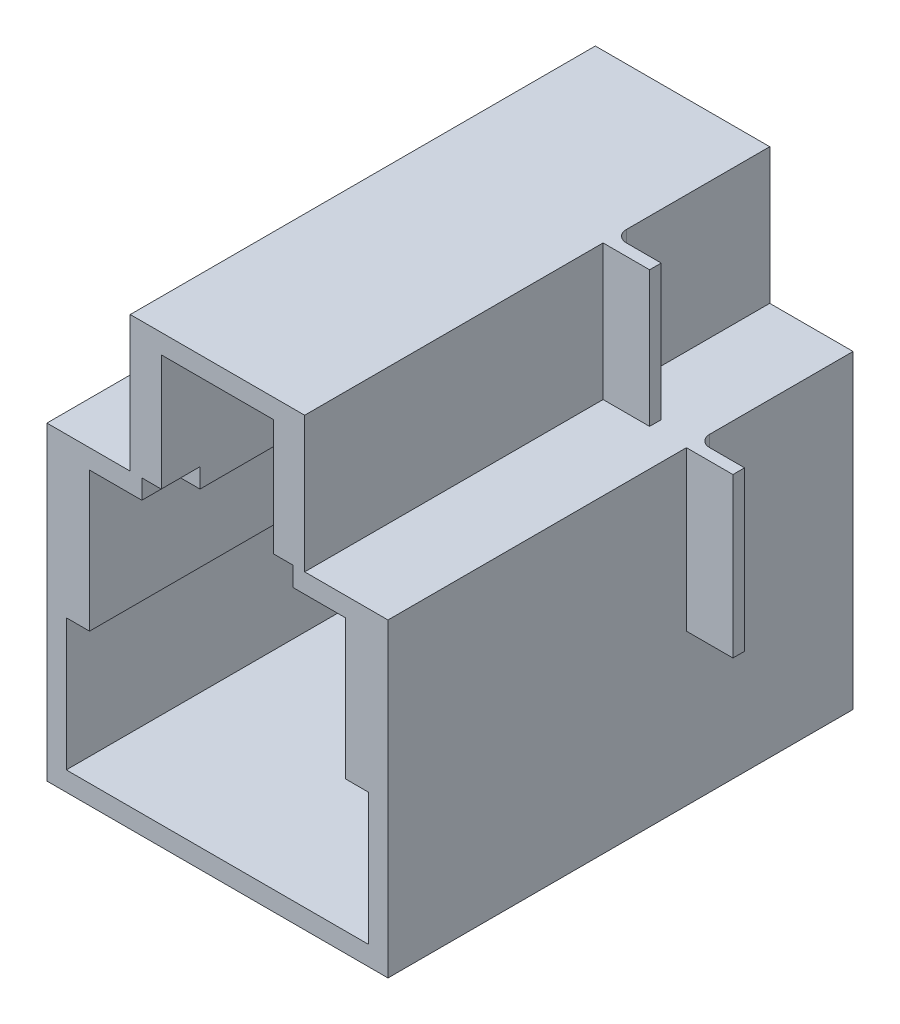
from build123d import *

# Parameters (mm, degrees)
BOSS_EXTRUDE1_DEPTH             = 60
SHELL1_T                        = -2.5
SKETCH2_W                       = 1.5
SKETCH2_H                       = 17.5
BOSS_EXTRUDE2_DEPTH             = 57.5
SKETCH4_W                       = 3
SKETCH4_H                       = 18
BOSS_EXTRUDE4_DEPTH             = 57.5
CUT_EXTRUDE1_DEPTH              = 86.966563267
CUT_EXTRUDE1_DEPTH_BACK         = 5
SKETCH5_W                       = 2.5
SKETCH5_H                       = 2.5
BOSS_EXTRUDE5_DEPTH             = 5
SKETCH13_W                      = 1.5
SKETCH13_H                      = 20.5
BOSS_EXTRUDE8_DEPTH             = 6
SKETCH14_W                      = 17.5
SKETCH14_H                      = 1.5
BOSS_EXTRUDE9_DEPTH             = 6
SKETCH15_W                      = 1.5
SKETCH15_H                      = 20.5
BOSS_EXTRUDE10_DEPTH            = 6
FILLET7_R                       = 1.5
CUT_EXTRUDE7_DEPTH              = 2.5
CUT_EXTRUDE7_DRAFT              = 30
CUT_EXTRUDE8_DEPTH              = 4
CUT_EXTRUDE8_DRAFT              = 30
REVOLVE4_ANGLE                  = 90
FILLET9_R                       = 1.5
BOSS_EXTRUDE13_DEPTH            = 2.5
BOSS_EXTRUDE14_DEPTH            = 4
CUT_EXTRUDE9_REACH              = 89.694
CUT_EXTRUDE9_DIRECTION_2_REACH  = 89.694
CUT_EXTRUDE10_REACH             = 88.076
CUT_EXTRUDE10_DIRECTION_2_REACH = 88.076
SKETCH27_W                      = 5
SKETCH27_H                      = 17
BOSS_EXTRUDE15_DEPTH            = 2.5
BOSS_EXTRUDE16_DEPTH            = 5.5
SKETCH29_W                      = 9.25
SKETCH29_H                      = 1.666666667
BOSS_EXTRUDE17_DEPTH            = 2.5
SKETCH30_W                      = 3.942307692
SKETCH30_H                      = 17.5
BOSS_EXTRUDE18_DEPTH            = 4
SKETCH31_W                      = 5
SKETCH31_H                      = 17
BOSS_EXTRUDE19_DEPTH            = 2.5
SKETCH32_W                      = 4.464285714
SKETCH32_H                      = 20.5
BOSS_EXTRUDE20_DEPTH            = 5.5
SKETCH35_W                      = 9.25
SKETCH35_H                      = 1.666666667
BOSS_EXTRUDE21_DEPTH            = 2.5
SKETCH36_W                      = 1.428571429
SKETCH36_H                      = 17.5
BOSS_EXTRUDE22_DEPTH            = 4
SKETCH37_W                      = 15.607142857
SKETCH37_H                      = 3.429487179
BOSS_EXTRUDE23_DEPTH            = 2.5
SKETCH38_W                      = 39
SKETCH38_H                      = 5
BOSS_EXTRUDE24_DEPTH            = 2.5


with BuildPart() as part:
    # Sketch1 → Boss-Extrude1 (new body)
    with BuildSketch(Plane.XY):
        Polygon((-22, 0), (22, 0), (22, 40), (11.25, 40), (11.25, 57.5), (-11.25, 57.5), (-11.25, 40), (-22, 40), align=None)
    extrude(amount=BOSS_EXTRUDE1_DEPTH)

    # Shell1
    shell1_openings = [part.faces().sort_by_distance(p)[0] for p in [
        (0, 25.256094022, 60),
    ]]
    offset(amount=SHELL1_T, openings=shell1_openings, kind=Kind.INTERSECTION)

    # Sketch2 → Boss-Extrude2 (add)
    with BuildSketch(Plane.XY.offset(2.5)):
        with Locations((-8, 46.25)):
            Rectangle(SKETCH2_W, SKETCH2_H)
        with Locations((8, 46.25)):
            Rectangle(SKETCH2_W, SKETCH2_H)
    extrude(amount=BOSS_EXTRUDE2_DEPTH)

    # Sketch4 → Boss-Extrude4 (add)
    with BuildSketch(Plane.XY.offset(2.5)):
        with Locations((-18, 28.5)):
            Rectangle(SKETCH4_W, SKETCH4_H)
        with Locations((18, 28.5)):
            Rectangle(SKETCH4_W, SKETCH4_H)
    extrude(amount=BOSS_EXTRUDE4_DEPTH)

    # Sketch5 → Cut-Extrude1 (cut, two sides: drawn at the far end of the back side and taken through both)
    with BuildSketch(Plane.XY.offset(60).offset(-CUT_EXTRUDE1_DEPTH_BACK)):
        with Locations((-8.5, 38.75)):
            Rectangle(SKETCH5_W, SKETCH5_H)
        with Locations((8.5, 38.75)):
            Rectangle(SKETCH5_W, SKETCH5_H)
    extrude(amount=CUT_EXTRUDE1_DEPTH + CUT_EXTRUDE1_DEPTH_BACK, mode=Mode.SUBTRACT)

    # Sketch7 → Boss-Extrude5 (add)
    with BuildSketch(Plane.XY.offset(2.5)):
        Polygon((-7.25, 55), (7.25, 55), (7.25, 37.5), (16.5, 37.5), (16.5, 19.5), (19.5, 19.5), (19.5, 2.5), (-19.5, 2.5), (-19.5, 19.5), (-16.5, 19.5), (-16.5, 37.5), (-7.25, 37.5), align=None)
    extrude(amount=BOSS_EXTRUDE5_DEPTH)

    # Sketch13 → Boss-Extrude8 (add)
    with BuildSketch(Plane.ZY.offset(22)):
        with Locations((20.75, 29.75)):
            Rectangle(SKETCH13_W, SKETCH13_H)
    extrude(amount=BOSS_EXTRUDE8_DEPTH)

    # Sketch14 → Boss-Extrude9 (add)
    with BuildSketch(Plane(origin=(11.25, 46.25, 0), x_dir=(0, 1, 0), z_dir=(-1, 0, 0))):
        with Locations((2.5, -20.75)):
            Rectangle(SKETCH14_W, SKETCH14_H)
    extrude(amount=-BOSS_EXTRUDE9_DEPTH)

    # Sketch15 → Boss-Extrude10 (add)
    with BuildSketch(Plane(origin=(22, 0, 0), x_dir=(0, 0, -1), z_dir=(1, 0, 0))):
        with Locations((-20.75, 29.75)):
            Rectangle(SKETCH15_W, SKETCH15_H)
    extrude(amount=BOSS_EXTRUDE10_DEPTH)

    # Fillet7
    fillet7_edges = [part.edges().sort_by_distance(p)[0] for p in [
        (-22, 29.75, 20),
        (11.25, 48.75, 20),
        (22, 29.75, 20),
    ]]
    fillet(fillet7_edges, radius=FILLET7_R)


with BuildPart() as cut_extrude7_tool:
    # Sketch21 → Cut-Extrude7 (with draft: the straight prism first)
    with BuildSketch(Plane(origin=(0, 40, 0), x_dir=(1, 0, 0), z_dir=(0, 1, 0))):
        with BuildLine():
            ThreePointArc((-11.25, -30), (-14.9, -33.65), (-11.25, -37.3))
            Line((-11.25, -37.3), (-7.25, -37.3))
            Line((-7.25, -37.3), (-7.25, -30))
            Line((-7.25, -30), (-11.25, -30))
        make_face()
    extrude(amount=-CUT_EXTRUDE7_DEPTH)
    # Cut-Extrude7: the draft: its side faces are tilted about the plane it starts from
    cut_extrude7_sides = [cut_extrude7_tool.faces().sort_by_distance(p)[0] for p in [
        (-9.25, 38.75, 30),
        (-14.9, 38.75, 33.65),
        (-9.25, 38.75, 37.3),
        (-7.25, 38.75, 33.65),
    ]]
    draft(cut_extrude7_sides, Plane(origin=(0, 40, 0), x_dir=(1, 0, 0), z_dir=(0, 1, 0)), CUT_EXTRUDE7_DRAFT)


with BuildPart() as part_1:
    add(part.part)

    # Cut-Extrude7: cut by cut_extrude7_tool
    add(cut_extrude7_tool.part, mode=Mode.SUBTRACT)


with BuildPart() as cut_extrude8_tool:
    # Sketch22 → Cut-Extrude8 (with draft: the straight prism first)
    with BuildSketch(Plane.ZY.offset(11.25)):
        with BuildLine():
            ThreePointArc((37.3, 40), (33.65, 43.65), (30, 40))
            Line((30, 40), (30, 37.5))
            Line((30, 37.5), (37.3, 37.5))
            Line((37.3, 37.5), (37.3, 40))
        make_face()
    extrude(amount=-CUT_EXTRUDE8_DEPTH)
    # Cut-Extrude8: the draft: its side faces are tilted about the plane it starts from
    cut_extrude8_sides = [cut_extrude8_tool.faces().sort_by_distance(p)[0] for p in [
        (-9.25, 38.75, 30),
        (-9.25, 37.5, 33.65),
        (-9.25, 38.75, 37.3),
        (-9.25, 43.65, 33.65),
    ]]
    draft(cut_extrude8_sides, Plane.ZY.offset(11.25), CUT_EXTRUDE8_DRAFT)


with BuildPart() as part_2:
    add(part_1.part)

    # Cut-Extrude8: cut by cut_extrude8_tool
    add(cut_extrude8_tool.part, mode=Mode.SUBTRACT)

    # Sketch23 → Revolve4 (revolve)
    with BuildSketch(Plane(origin=(0, 40, 0), x_dir=(1, 0, 0), z_dir=(0, 1, 0))):
        with BuildLine():
            Line((-14.634221069, -32.282685934), (-18.55, -41.974578887))
            Line((-18.55, -41.974578887), (-19.755339011, -41.487590315))
            Line((-19.755339011, -41.487590315), (-15.83956008, -31.795697363))
            ThreePointArc((-15.83956008, -31.795697363), (-14.018004872, -29.546264016), (-11.25, -28.7))
            Line((-11.25, -28.7), (-11.25, -30))
            ThreePointArc((-11.25, -30), (-13.291054098, -30.62401286), (-14.634221069, -32.282685934))
        make_face()
    revolve(axis=Axis((-11.25, 40, 30), (0, 0, -1)), revolution_arc=REVOLVE4_ANGLE)

    # Fillet9
    fillet9_edges = [part_2.edges().sort_by_distance(p)[0] for p in [
        (-14.018004872, 40, 29.546264016),
        (-17.797449546, 40, 36.641643839),
        (-11.25, 42.768004872, 29.546264016),
        (-11.25, 46.547449546, 36.641643839),
    ]]
    fillet(fillet9_edges, radius=FILLET9_R)

    # Sketch24 → Boss-Extrude13 (add)
    with BuildSketch(Plane.XZ.offset(-37.5)):
        with BuildLine():
            Line((-11.25, 37.3), (-7.25, 37.3))
            Line((-7.25, 37.3), (-7.25, 39.609401077))
            Line((-7.25, 39.609401077), (-11.25, 39.609401077))
            Line((-11.25, 39.609401077), (-16.5, 39.609401077))
            Line((-16.5, 39.609401077), (-16.5, 33.761079936))
            Line((-16.5, 33.761079936), (-14.898309368, 33.761079936))
            ThreePointArc((-14.898309368, 33.761079936), (-13.791363633, 36.269918106), (-11.25, 37.3))
        make_face()
    extrude(amount=-BOSS_EXTRUDE13_DEPTH)

    # Sketch25 → Boss-Extrude14 (add)
    with BuildSketch(Plane(origin=(-7.25, 0, 0), x_dir=(0, 0, -1), z_dir=(1, 0, 0))):
        with BuildLine():
            Line((-37.3, 37.5), (-37.3, 40))
            ThreePointArc((-37.3, 40), (-36.230939751, 42.580939751), (-33.65, 43.65))
            Line((-33.65, 43.65), (-33.65, 45.959401077))
            ThreePointArc((-33.65, 45.959401077), (-37.863932913, 44.213932913), (-39.609401077, 40))
            Line((-39.609401077, 40), (-39.609401077, 37.5))
            Line((-39.609401077, 37.5), (-37.3, 37.5))
        make_face()
    extrude(amount=-BOSS_EXTRUDE14_DEPTH)

    # Sketch26 → Cut-Extrude9 (cut, up to next)
    with BuildSketch(Plane(origin=(0, 0, 0), x_dir=(0, 0, -1), z_dir=(1, 0, 0)), mode=Mode.PRIVATE) as cut_extrude9_sk1:
        Polygon((-7.5, 55), (-7.5, 2.5), (-2.5, 2.5), align=None)
    cut_extrude9_tool1 = extrude(cut_extrude9_sk1.sketch, amount=-CUT_EXTRUDE9_REACH, mode=Mode.PRIVATE) & part_2.part
    add(cut_extrude9_tool1.solids().sort_by_distance((0, 20, 5.833333))[0], mode=Mode.SUBTRACT)

    # Sketch26 → Cut-Extrude9 direction 2 (cut, up to next)
    with BuildSketch(Plane(origin=(0, 0, 0), x_dir=(0, 0, -1), z_dir=(1, 0, 0)), mode=Mode.PRIVATE) as cut_extrude9_direction_2_sk1:
        Polygon((-7.5, 55), (-7.5, 2.5), (-2.5, 2.5), align=None)
    cut_extrude9_direction_2_tool1 = extrude(cut_extrude9_direction_2_sk1.sketch, amount=CUT_EXTRUDE9_DIRECTION_2_REACH, mode=Mode.PRIVATE) & part_2.part
    add(cut_extrude9_direction_2_tool1.solids().sort_by_distance((0, 20, 5.833333))[0], mode=Mode.SUBTRACT)

    # Sketch33 → Cut-Extrude10 (cut, up to next)
    with BuildSketch(Plane(origin=(0, 2.5, 0), x_dir=(1, 0, 0), z_dir=(0, 1, 0)), mode=Mode.PRIVATE) as cut_extrude10_sk1:
        Polygon((-19.5, -7.5), (19.5, -7.5), (-19.5, -2.5), align=None)
    cut_extrude10_tool1 = extrude(cut_extrude10_sk1.sketch, amount=CUT_EXTRUDE10_REACH, mode=Mode.PRIVATE) & part_2.part
    add(cut_extrude10_tool1.solids().sort_by_distance((-6.5, 2.5, 5.833333))[0], mode=Mode.SUBTRACT)

    # Sketch33 → Cut-Extrude10 direction 2 (cut, up to next)
    with BuildSketch(Plane(origin=(0, 2.5, 0), x_dir=(1, 0, 0), z_dir=(0, 1, 0)), mode=Mode.PRIVATE) as cut_extrude10_direction_2_sk1:
        Polygon((-19.5, -7.5), (19.5, -7.5), (-19.5, -2.5), align=None)
    cut_extrude10_direction_2_tool1 = extrude(cut_extrude10_direction_2_sk1.sketch, amount=-CUT_EXTRUDE10_DIRECTION_2_REACH, mode=Mode.PRIVATE) & part_2.part
    add(cut_extrude10_direction_2_tool1.solids().sort_by_distance((-6.5, 2.5, 5.833333))[0], mode=Mode.SUBTRACT)

    # Sketch27 → Boss-Extrude15 (add)
    with BuildSketch(Plane.ZY.offset(22)):
        with Locations((5, 11)):
            Rectangle(SKETCH27_W, SKETCH27_H)
    extrude(amount=-BOSS_EXTRUDE15_DEPTH)

    # Sketch27<4> → Boss-Extrude16 (add)
    with BuildSketch(Plane.ZY.offset(22)):
        Polygon((4.119047619, 19.5), (7.5, 19.5), (7.5, 40), (6.071428571, 40), align=None)
    extrude(amount=-BOSS_EXTRUDE16_DEPTH)

    # Sketch29 → Boss-Extrude17 (add)
    with BuildSketch(Plane.XZ.offset(-37.5)):
        with Locations((-11.875, 6.666666667)):
            Rectangle(SKETCH29_W, SKETCH29_H)
    extrude(amount=-BOSS_EXTRUDE17_DEPTH)

    # Sketch30 → Boss-Extrude18 (add)
    with BuildSketch(Plane.ZY.offset(11.25)):
        with Locations((5.528846154, 48.75)):
            Rectangle(SKETCH30_W, SKETCH30_H)
    extrude(amount=-BOSS_EXTRUDE18_DEPTH)

    # Sketch31 → Boss-Extrude19 (add)
    with BuildSketch(Plane.ZY.offset(-19.5)):
        with Locations((5, 11)):
            Rectangle(SKETCH31_W, SKETCH31_H)
    extrude(amount=-BOSS_EXTRUDE19_DEPTH)

    # Sketch32 → Boss-Extrude20 (add)
    with BuildSketch(Plane(origin=(22, 0, 0), x_dir=(0, 0, -1), z_dir=(1, 0, 0))):
        with Locations((-5.267857143, 29.75)):
            Rectangle(SKETCH32_W, SKETCH32_H)
    extrude(amount=-BOSS_EXTRUDE20_DEPTH)

    # Sketch35 → Boss-Extrude21 (add)
    with BuildSketch(Plane.XZ.offset(-37.5)):
        with Locations((11.875, 6.666666667)):
            Rectangle(SKETCH35_W, SKETCH35_H)
    extrude(amount=-BOSS_EXTRUDE21_DEPTH)

    # Sketch36 → Boss-Extrude22 (add)
    with BuildSketch(Plane(origin=(11.25, 0, 0), x_dir=(0, 0, -1), z_dir=(1, 0, 0))):
        with Locations((-6.785714286, 48.75)):
            Rectangle(SKETCH36_W, SKETCH36_H)
    extrude(amount=-BOSS_EXTRUDE22_DEPTH)

    # Sketch37 → Boss-Extrude23 (add)
    with BuildSketch(Plane(origin=(0, 57.5, 0), x_dir=(1, 0, 0), z_dir=(0, 1, 0))):
        with Locations((0.553571429, -5.785256411)):
            Rectangle(SKETCH37_W, SKETCH37_H)
    extrude(amount=-BOSS_EXTRUDE23_DEPTH)

    # Sketch38 → Boss-Extrude24 (add)
    with BuildSketch(Plane.XZ):
        with Locations((0, 5)):
            Rectangle(SKETCH38_W, SKETCH38_H)
    extrude(amount=-BOSS_EXTRUDE24_DEPTH)


solid = part_2.part
